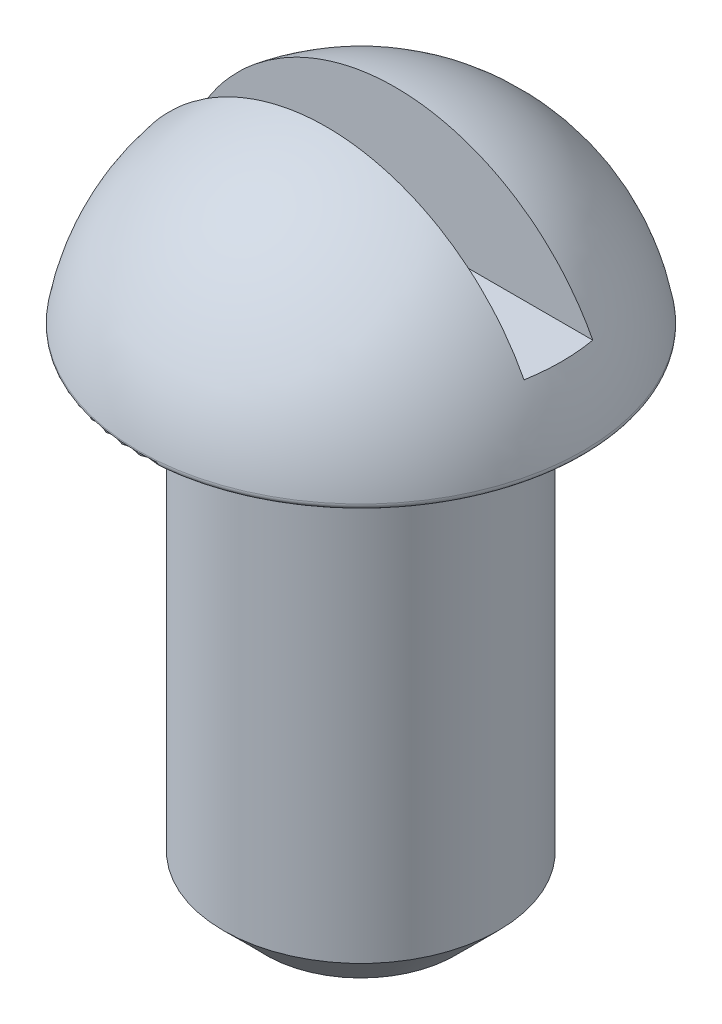
from build123d import *

# Parameters (mm, degrees)
SKETCH_13_W         = 13
SKETCH_13_H         = 2
CUT_EXTRUDE_9_DEPTH = 3.5
FILLET_1_R          = 0.15
CHAMFER_1_SIZE      = 1.25


with BuildPart() as part:
    # Эскиз1 → Повернуть1 (revolve)
    with BuildSketch(Plane.XY):
        with BuildLine():
            Line((4, 88.64931314), (6.5, 88.64931314))
            ThreePointArc((6.5, 88.64931314), (4.672942151, 92.355774181), (1, 94.24931314))
            Line((1, 94.24931314), (0, 94.24931314))
            Line((0, 94.24931314), (0, 74.24931314))
            Line((0, 74.24931314), (4, 74.24931314))
            Line((4, 74.24931314), (4, 88.64931314))
        make_face()
    revolve(axis=Axis((0, 125.763182898, 0), (0, -1, 0)))

    # Эскиз13 → Вырез-Вытянуть9 (cut)
    with BuildSketch(Plane(origin=(0, 94.24931314, 0), x_dir=(-1, 0, 0), z_dir=(0, 1, 0))):
        Rectangle(SKETCH_13_W, SKETCH_13_H)
    extrude(amount=-CUT_EXTRUDE_9_DEPTH, mode=Mode.SUBTRACT)

    # Скругление1
    fillet_1_edges = [part.edges().sort_by_distance(p)[0] for p in [
        (-6.5, 88.64931314, 0),
    ]]
    fillet(fillet_1_edges, radius=FILLET_1_R)

    # Фаска1
    chamfer_1_edges = [part.edges().sort_by_distance(p)[0] for p in [
        (-4, 74.24931314, 0),
    ]]
    chamfer(chamfer_1_edges, length=CHAMFER_1_SIZE)


solid = part.part
